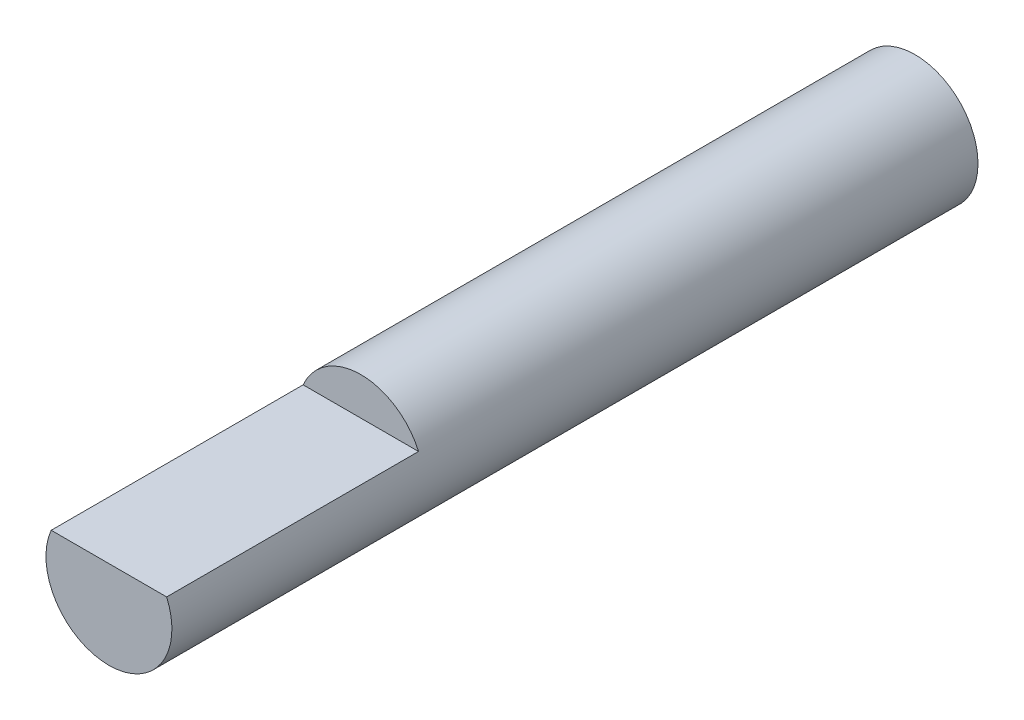
from build123d import *

# Parameters (mm, degrees)
CROQUIS2_R              = 2.5
SALIENTE_EXTRUIR1_DEPTH = 32
CORTAR_EXTRUIR1_START   = -10
CORTAR_EXTRUIR1_DEPTH   = 10


with BuildPart() as part:
    # Croquis2 → Saliente-Extruir1 (new body)
    with BuildSketch(Plane.XY):
        Circle(CROQUIS2_R)
    extrude(amount=SALIENTE_EXTRUIR1_DEPTH)

    # Croquis3 → Cortar-Extruir1 (cut)
    with BuildSketch(Plane.XY.offset(32).offset(CORTAR_EXTRUIR1_START)):
        with BuildLine():
            Line((-2.291287847, 1), (2.291287847, 1))
            ThreePointArc((2.291287847, 1), (0, 2.5), (-2.291287847, 1))
        make_face()
    extrude(amount=CORTAR_EXTRUIR1_DEPTH, mode=Mode.SUBTRACT)


solid = part.part
